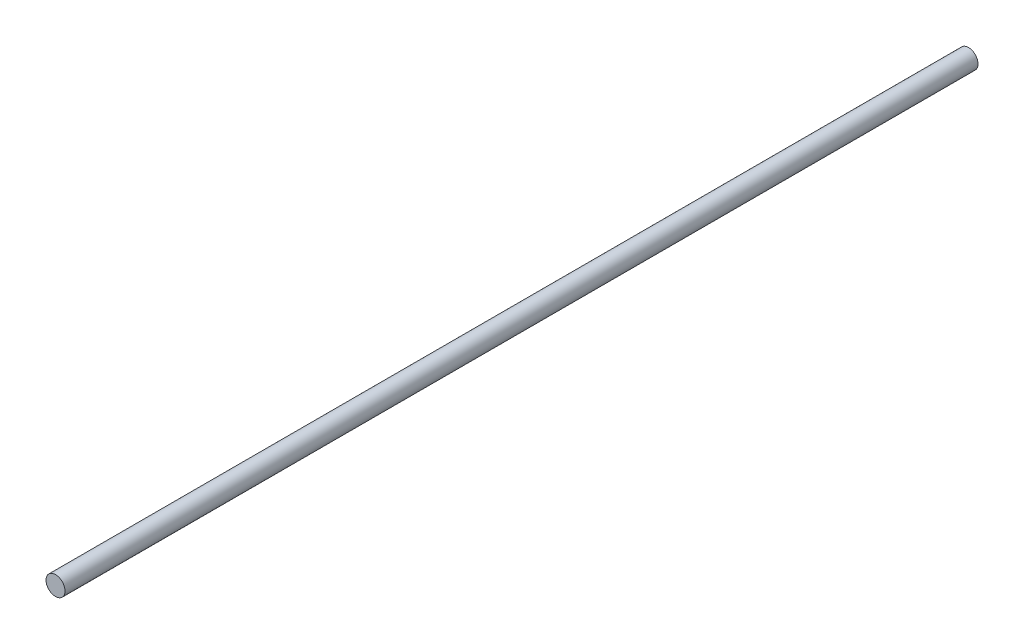
from build123d import *

# Parameters (mm, degrees)
SKETCH1_R           = 6.35
BOSS_EXTRUDE1_DEPTH = 609.6


with BuildPart() as part:
    # Sketch1 → Boss-Extrude1 (new body)
    with BuildSketch(Plane.XY):
        with Locations(Location((0, 0, 0), (0, 0, 180))):
            Circle(SKETCH1_R)
    extrude(amount=BOSS_EXTRUDE1_DEPTH)


solid = part.part
